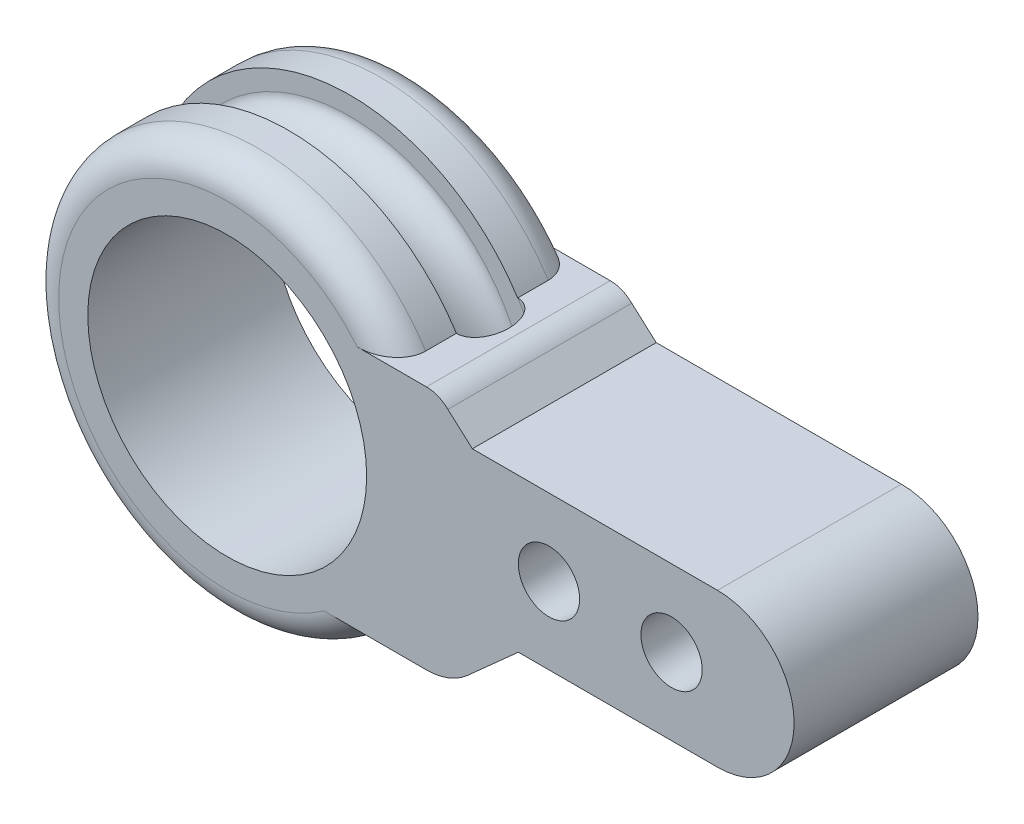
from build123d import *

# Parameters (mm, degrees)
BOSS_EXTRUDE1_DEPTH = 6
SKETCH1_5_R         = 4.55
CUT_EXTRUDE2_DEPTH  = 21.506096654
SKETCH1_6_R         = 1
CUT_EXTRUDE3_DEPTH  = 21.506096654
FILLET1_R           = 1


with BuildPart() as part:
    # Sketch1 → Boss-Extrude1 (new body)
    with BuildSketch(Plane.XY):
        with BuildLine():
            Line((9.5, -2.5), (16, -2.5))
            ThreePointArc((16, -2.5), (18.5, 0), (16, 2.5))
            Line((16, 2.5), (8, 2.5))
            Line((8, 2.5), (7.201136344, 3.213027227))
            ThreePointArc((7.201136344, 3.213027227), (6.878795969, 3.425480207), (6.5, 3.5))
            Line((6.5, 3.5), (5.477225575, 3.5))
            ThreePointArc((5.477225575, 3.5), (-6.468789112, 0.636213346), (4.69041576, -4.5))
            Line((4.69041576, -4.5), (6.5, -4.5))
            ThreePointArc((6.5, -4.5), (7.21364418, -4.368344718), (7.833333333, -3.990711985))
            Line((7.833333333, -3.990711985), (9.5, -2.5))
        make_face()
    extrude(amount=BOSS_EXTRUDE1_DEPTH)

    # Sketch1<5> → Cut-Extrude2 (cut, through all)
    with BuildSketch(Plane.XY):
        Circle(SKETCH1_5_R)
    extrude(amount=CUT_EXTRUDE2_DEPTH, mode=Mode.SUBTRACT)

    # Sketch1<6> → Cut-Extrude3 (cut, through all)
    with BuildSketch(Plane.XY):
        with Locations((14.5, 0)):
            Circle(SKETCH1_6_R)
        with Locations((10.5, 0)):
            Circle(SKETCH1_6_R)
    extrude(amount=CUT_EXTRUDE3_DEPTH, mode=Mode.SUBTRACT)

    # Sketch5 → Cut-Revolve2 (revolve, cut)
    with BuildSketch(Plane(origin=(0, 0, 0), x_dir=(0, 0, -1), z_dir=(1, 0, 0))):
        with BuildLine():
            Line((-3.998431193, 6.509033472), (-3.998431193, 5.899033472))
            add(Edge.make_bspline(
                [(-3.998431193, 5.899033472), (-3.998431193, 5.299033472), (-2.998431193, 5.299033472), (-1.998431193, 5.299033472), (-1.998431193, 5.899033472)],
                knots=[0, 0, 0, 1.570796327, 1.570796327, 3.141592654, 3.141592654, 3.141592654], degree=2, weights=[1, 0.707106781, 1, 0.707106781, 1]))
            Line((-1.998431193, 5.899033472), (-1.998431193, 6.509033472))
            add(Edge.make_bspline(
                [(-1.998431193, 6.509033472), (-1.998431193, 7.109033472), (-2.998431193, 7.109033472), (-3.998431193, 7.109033472), (-3.998431193, 6.509033472)],
                knots=[3.141592654, 3.141592654, 3.141592654, 4.71238898, 4.71238898, 6.283185307, 6.283185307, 6.283185307], degree=2, weights=[1, 0.707106781, 1, 0.707106781, 1]))
        make_face()
    revolve(axis=Axis((0, 0, 6.969963605), (0, 0, -1)), mode=Mode.SUBTRACT)

    # Fillet1
    fillet1_edges = [part.edges().sort_by_distance(p)[0] for p in [
        (-6.468789112, 0.636213346, 6),
        (-6.468789112, 0.636213346, 0),
    ]]
    fillet(fillet1_edges, radius=FILLET1_R)


solid = part.part
